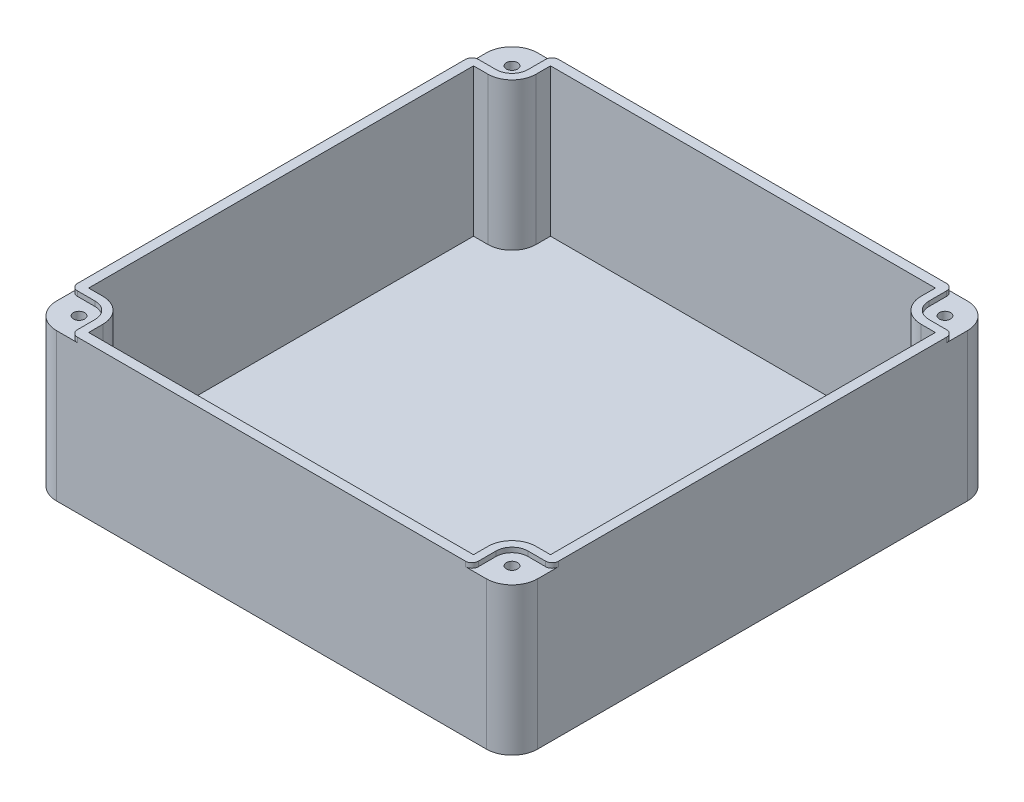
from build123d import *

# Parameters (mm, degrees)
BOSS_EXTRUDE1_DEPTH = 46
BOSS_EXTRUDE2_START = 1.5
BOSS_EXTRUDE2_DEPTH = 1.5
SKETCH1_4_R         = 1.75
CUT_EXTRUDE1_DEPTH  = 13
BOSS_EXTRUDE3_START = -1.5
BOSS_EXTRUDE3_DEPTH = 1.5
FILLET1_R           = 2


with BuildPart() as part:
    # Sketch1 → Boss-Extrude1 (new body)
    with BuildSketch(Plane(origin=(0, 0, 0), x_dir=(1, 0, 0), z_dir=(0, 1, 0))):
        with BuildLine():
            ThreePointArc((-75, -67), (-72.656854249, -72.656854249), (-67, -75))
            Line((-67, -75), (67, -75))
            ThreePointArc((67, -75), (72.656854249, -72.656854249), (75, -67))
            Line((75, -67), (75, 67))
            ThreePointArc((75, 67), (72.656854249, 72.656854249), (67, 75))
            Line((67, 75), (-67, 75))
            ThreePointArc((-67, 75), (-72.656854249, 72.656854249), (-75, 67))
            Line((-75, 67), (-75, -67))
        make_face()
        with BuildLine():
            ThreePointArc((-67.5, 60), (-62.196699141, 62.196699141), (-60, 67.5))
            Line((-60, 67.5), (-60, 72))
            Line((-60, 72), (60, 72))
            Line((60, 72), (60, 67.5))
            ThreePointArc((60, 67.5), (62.196699141, 62.196699141), (67.5, 60))
            Line((67.5, 60), (72, 60))
            Line((72, 60), (72, -60))
            Line((72, -60), (67.5, -60))
            ThreePointArc((67.5, -60), (62.196699141, -62.196699141), (60, -67.5))
            Line((60, -67.5), (60, -72))
            Line((60, -72), (-60, -72))
            Line((-60, -72), (-60, -67.5))
            ThreePointArc((-60, -67.5), (-62.196699141, -62.196699141), (-67.5, -60))
            Line((-67.5, -60), (-72, -60))
            Line((-72, -60), (-72, 60))
            Line((-72, 60), (-67.5, 60))
        make_face(mode=Mode.SUBTRACT)
    extrude(amount=-BOSS_EXTRUDE1_DEPTH)

    # Sketch1<3> → Boss-Extrude2 (add)
    with BuildSketch(Plane(origin=(0, 0, 0), x_dir=(1, 0, 0), z_dir=(0, 1, 0)).offset(BOSS_EXTRUDE2_START)):
        with BuildLine():
            Line((-62.5, -67.5), (-62.5, -75))
            Line((-62.5, -75), (62.5, -75))
            Line((62.5, -75), (62.5, -67.5))
            ThreePointArc((62.5, -67.5), (63.964466094, -63.964466094), (67.5, -62.5))
            Line((67.5, -62.5), (75, -62.5))
            Line((75, -62.5), (75, 62.5))
            Line((75, 62.5), (67.5, 62.5))
            ThreePointArc((67.5, 62.5), (63.964466094, 63.964466094), (62.5, 67.5))
            Line((62.5, 67.5), (62.5, 75))
            Line((62.5, 75), (-62.5, 75))
            Line((-62.5, 75), (-62.5, 67.5))
            ThreePointArc((-62.5, 67.5), (-63.964466094, 63.964466094), (-67.5, 62.5))
            Line((-67.5, 62.5), (-75, 62.5))
            Line((-75, 62.5), (-75, -62.5))
            Line((-75, -62.5), (-67.5, -62.5))
            ThreePointArc((-67.5, -62.5), (-63.964466094, -63.964466094), (-62.5, -67.5))
        make_face()
        with BuildLine():
            Line((-67.5, -60), (-72, -60))
            Line((-72, -60), (-72, 60))
            Line((-72, 60), (-67.5, 60))
            ThreePointArc((-67.5, 60), (-62.196699141, 62.196699141), (-60, 67.5))
            Line((-60, 67.5), (-60, 72))
            Line((-60, 72), (60, 72))
            Line((60, 72), (60, 67.5))
            ThreePointArc((60, 67.5), (62.196699141, 62.196699141), (67.5, 60))
            Line((67.5, 60), (72, 60))
            Line((72, 60), (72, -60))
            Line((72, -60), (67.5, -60))
            ThreePointArc((67.5, -60), (62.196699141, -62.196699141), (60, -67.5))
            Line((60, -67.5), (60, -72))
            Line((60, -72), (-60, -72))
            Line((-60, -72), (-60, -67.5))
            ThreePointArc((-60, -67.5), (-62.196699141, -62.196699141), (-67.5, -60))
        make_face(mode=Mode.SUBTRACT)
    extrude(amount=-BOSS_EXTRUDE2_DEPTH)

    # Sketch1<4> → Cut-Extrude1 (cut)
    with BuildSketch(Plane(origin=(0, 0, 0), x_dir=(1, 0, 0), z_dir=(0, 1, 0))):
        with Locations((-67.5, 67.5)):
            Circle(SKETCH1_4_R)
        with Locations((67.5, 67.5)):
            Circle(SKETCH1_4_R)
        with Locations((67.5, -67.5)):
            Circle(SKETCH1_4_R)
        with Locations((-67.5, -67.5)):
            Circle(SKETCH1_4_R)
    extrude(amount=-CUT_EXTRUDE1_DEPTH, mode=Mode.SUBTRACT)

    # Sketch2 → Boss-Extrude3 (add)
    with BuildSketch(Plane.XZ.offset(46).offset(BOSS_EXTRUDE3_START)):
        with BuildLine():
            Line((-75, 67), (-75, -67))
            ThreePointArc((-75, -67), (-72.656854249, -72.656854249), (-67, -75))
            Line((-67, -75), (67, -75))
            ThreePointArc((67, -75), (72.656854249, -72.656854249), (75, -67))
            Line((75, -67), (75, 67))
            ThreePointArc((75, 67), (72.656854249, 72.656854249), (67, 75))
            Line((67, 75), (-67, 75))
            ThreePointArc((-67, 75), (-72.656854249, 72.656854249), (-75, 67))
        make_face()
    extrude(amount=BOSS_EXTRUDE3_DEPTH)

    # Fillet1
    fillet1_edges = [part.edges().sort_by_distance(p)[0] for p in [
        (62.5, 0.75, -75),
        (75, 0.75, -62.5),
        (75, 0.75, 62.5),
        (62.5, 0.75, 75),
        (-62.5, 0.75, 75),
        (-75, 0.75, 62.5),
        (-75, 0.75, -62.5),
        (-62.5, 0.75, -75),
    ]]
    fillet(fillet1_edges, radius=FILLET1_R)


solid = part.part
